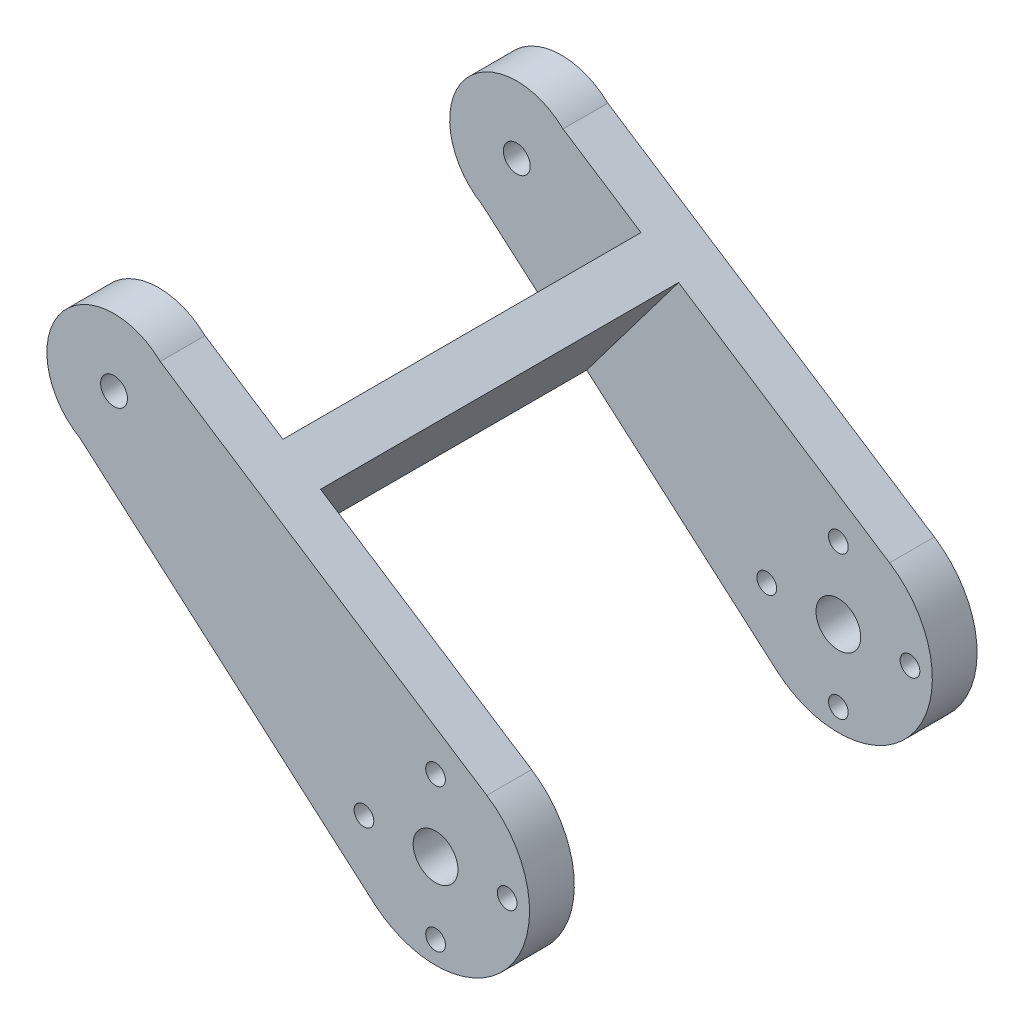
from build123d import *

# Parameters (mm, degrees)
ESQUISSE1_R        = 1.1
ESQUISSE1_R_2      = 1.5
ESQUISSE1_R_3      = 2.5
BOSS_EXTRU_1_DEPTH = 5
BOSS_EXTRU_2_DEPTH = 20


with BuildPart() as part:
    # Esquisse1 → Boss.-Extru.1 (new body)
    with BuildSketch(Plane.XY):
        with BuildLine():
            Line((5.726385479, 8.801051605), (-30.755113053, 32.537660912))
            ThreePointArc((-30.755113053, 32.537660912), (-41.910189263, 31.619393351), (-39.730753447, 20.640823312))
            Line((-39.730753447, 20.640823312), (-6.890823906, -7.922534058))
            ThreePointArc((-6.890823906, -7.922534058), (8.382037853, -6.32387867), (5.726385479, 8.801051605))
        make_face()
        with Locations((0, 8)):
            Circle(ESQUISSE1_R, mode=Mode.SUBTRACT)
        with Locations((8, 0)):
            Circle(ESQUISSE1_R, mode=Mode.SUBTRACT)
        with Locations((0, -8)):
            Circle(ESQUISSE1_R, mode=Mode.SUBTRACT)
        with Locations((-8, 0)):
            Circle(ESQUISSE1_R, mode=Mode.SUBTRACT)
        with Locations((-35.923019369, 27.102337158)):
            Circle(ESQUISSE1_R_2, mode=Mode.SUBTRACT)
        Circle(ESQUISSE1_R_3, mode=Mode.SUBTRACT)
    boss_extru_1 = extrude(amount=BOSS_EXTRU_1_DEPTH)

    # Esquisse2 → Boss.-Extru.2 (add)
    with BuildSketch(Plane(origin=(0, 0, 0), x_dir=(-1, 0, 0), z_dir=(0, 0, -1))):
        Polygon((17.847870487, 24.139591031), (28.111906813, 10.535038273), (31.893676134, 13.824327565), (22.048994358, 26.873043329), align=None)
    boss_extru_2 = extrude(amount=BOSS_EXTRU_2_DEPTH)

    # Symétrie1: Boss.-Extru.1, Boss.-Extru.2 across plane
    add(boss_extru_1.mirror(Plane.XY.offset(-20)))
    add(boss_extru_2.mirror(Plane.XY.offset(-20)))


solid = part.part
